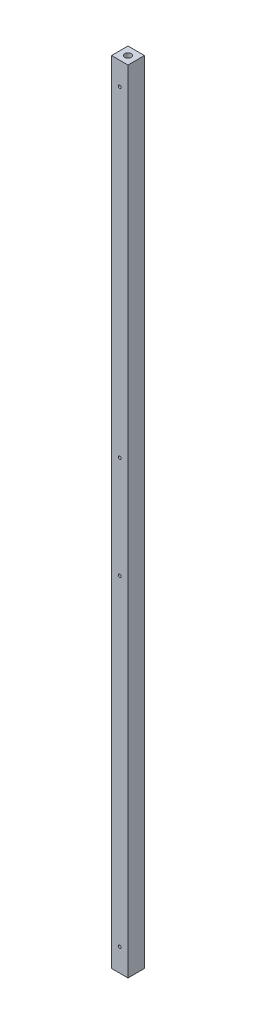
from build123d import *

# Parameters (mm, degrees)
SKETCH1_W             = 12.7
SKETCH1_H             = 12.7
BOSS_EXTRUDE1_DEPTH   = 609.6
F_4_40_TAPPED_HOLE2_D = 2.2606


with BuildPart() as part:
    # Sketch1 → Boss-Extrude1 (new body)
    with BuildSketch(Plane(origin=(0, 0, 0), x_dir=(1, 0, 0), z_dir=(0, 1, 0))):
        Rectangle(SKETCH1_W, SKETCH1_H)
    extrude(amount=BOSS_EXTRUDE1_DEPTH)

    # Sketch8 → 1/4-20 Tapped Hole1 (revolve, cut)
    with BuildSketch(Plane(origin=(0, 0, 0), x_dir=(0, 0, -1), z_dir=(1, 0, 0))):
        Polygon((0, 0), (0, 14.233816902), (2.5527, 12.7), (2.5527, 0), align=None)
    f_1_4_20_tapped_hole1 = revolve(axis=Axis((0, -6.35, 0), (0, 1, 0)), mode=Mode.SUBTRACT)

    # #4-40 Tapped Hole2 (through all)
    with Locations(Plane(origin=(0, 17.752734497, 6.35), x_dir=(1, 0, 0), z_dir=(0, 0, 1))):
        with Locations((0, 0), (0, 247.65)):
            f_4_40_tapped_hole2 = Hole(F_4_40_TAPPED_HOLE2_D / 2)

    # Mirror1: 1/4-20 Tapped Hole1, #4-40 Tapped Hole2 across plane
    add(f_1_4_20_tapped_hole1.mirror(Plane.ZX.offset(304.8)), mode=Mode.SUBTRACT)
    add(f_4_40_tapped_hole2.mirror(Plane.ZX.offset(304.8)), mode=Mode.SUBTRACT)


solid = part.part
